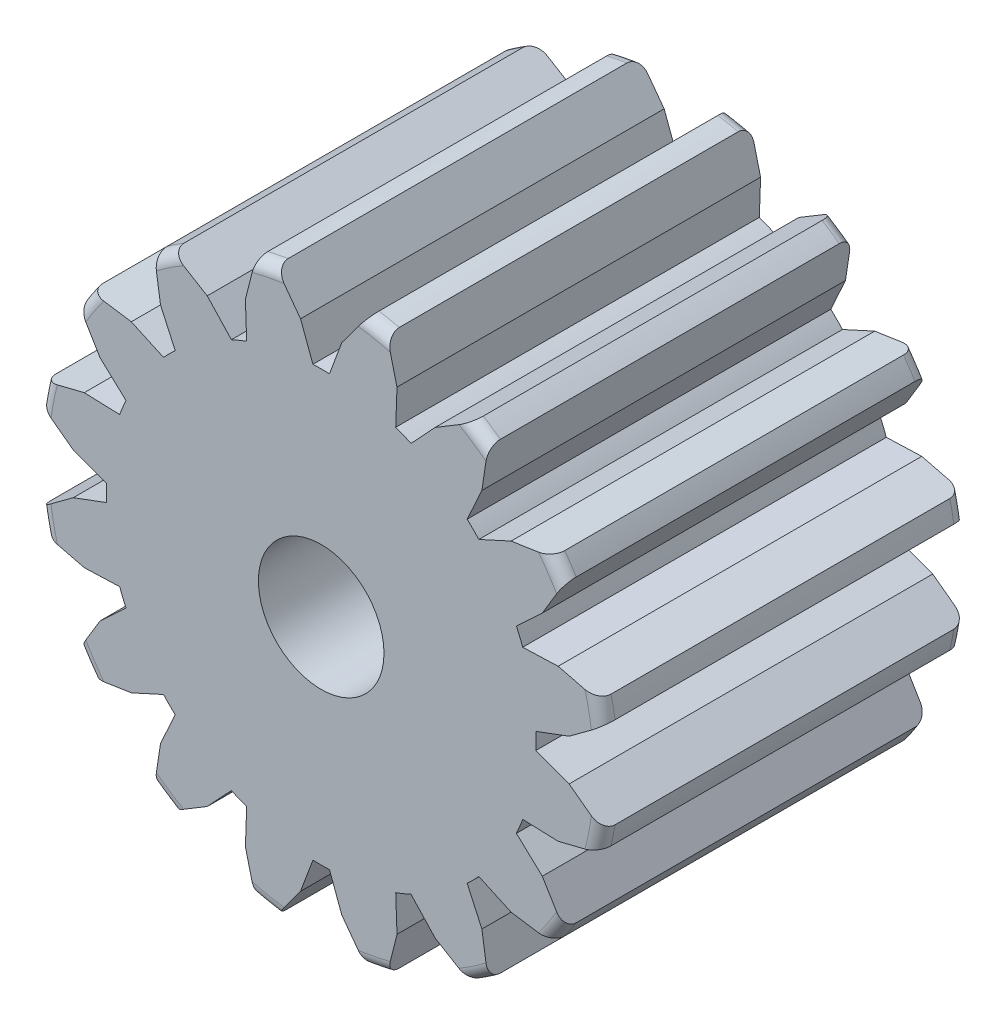
from build123d import *

# Parameters (mm, degrees)
CROQUIS1_R              = 3.45
SALIENTE_EXTRUIR1_DEPTH = 4.4
CORTAR_EXTRUIR1_START   = -4.4
CORTAR_EXTRUIR1_DEPTH   = 4.4
REDONDEO1_R             = 0.15
MATRIZC1_COUNT          = 16
CROQUIS2_3_R            = 0.76
CORTAR_EXTRUIR2_DEPTH   = 4.4


with BuildPart() as part:
    # Croquis1 → Saliente-Extruir1 (new body)
    with BuildSketch(Plane.XY):
        Circle(CROQUIS1_R)
    extrude(amount=SALIENTE_EXTRUIR1_DEPTH)

    # Croquis2 → Cortar-Extruir1 (cut)
    with BuildSketch(Plane.XY.offset(4.4).offset(CORTAR_EXTRUIR1_START)):
        with BuildLine():
            Line((0, 3.7), (0, 3.45))
            ThreePointArc((0, 3.45), (0.275883497, 3.438951627), (0.55, 3.405877273))
            Line((0.55, 3.405877273), (0.55, 3.7))
            Line((0.55, 3.7), (0, 3.7))
        make_face()
        with BuildLine():
            ThreePointArc((-0.55, 3.405877273), (-0.275883497, 3.438951627), (0, 3.45))
            Line((0, 3.45), (0, 3.7))
            Line((0, 3.7), (-0.55, 3.7))
            Line((-0.55, 3.7), (-0.55, 3.405877273))
        make_face()
        with BuildLine():
            ThreePointArc((-0.1, 2.598076211), (-0.050009252, 2.599519008), (0, 2.6))
            Line((0, 2.6), (0, 3.45))
            ThreePointArc((0, 3.45), (-0.275883497, 3.438951627), (-0.55, 3.405877273))
            Line((-0.55, 3.405877273), (-0.25, 3))
            Line((-0.25, 3), (-0.1, 2.598076211))
        make_face()
        with BuildLine():
            Line((0, 3.45), (0, 2.6))
            ThreePointArc((0, 2.6), (0.050009252, 2.599519008), (0.1, 2.598076211))
            Line((0.1, 2.598076211), (0.25, 3))
            Line((0.25, 3), (0.55, 3.405877273))
            ThreePointArc((0.55, 3.405877273), (0.275883497, 3.438951627), (0, 3.45))
        make_face()
    cortar_extruir1 = extrude(amount=CORTAR_EXTRUIR1_DEPTH, mode=Mode.SUBTRACT)

    # Redondeo1
    redondeo1_edges = [part.edges().sort_by_distance(p)[0] for p in [
        (0, -3.45, 0),
        (0, -3.45, 4.4),
    ]]
    fillet(redondeo1_edges, radius=REDONDEO1_R)

    # MatrizC1: Cortar-Extruir1 ×16 about axis
    matrizc1_axis = Axis((0, 0, 0), (0, 0, 1))
    for i in range(1, MATRIZC1_COUNT):
        add(cortar_extruir1.rotate(matrizc1_axis, i * 360 / MATRIZC1_COUNT), mode=Mode.SUBTRACT)

    # Croquis2<3> → Cortar-Extruir2 (cut)
    with BuildSketch(Plane.XY.offset(4.4)):
        Circle(CROQUIS2_3_R)
    extrude(amount=-CORTAR_EXTRUIR2_DEPTH, mode=Mode.SUBTRACT)


solid = part.part
